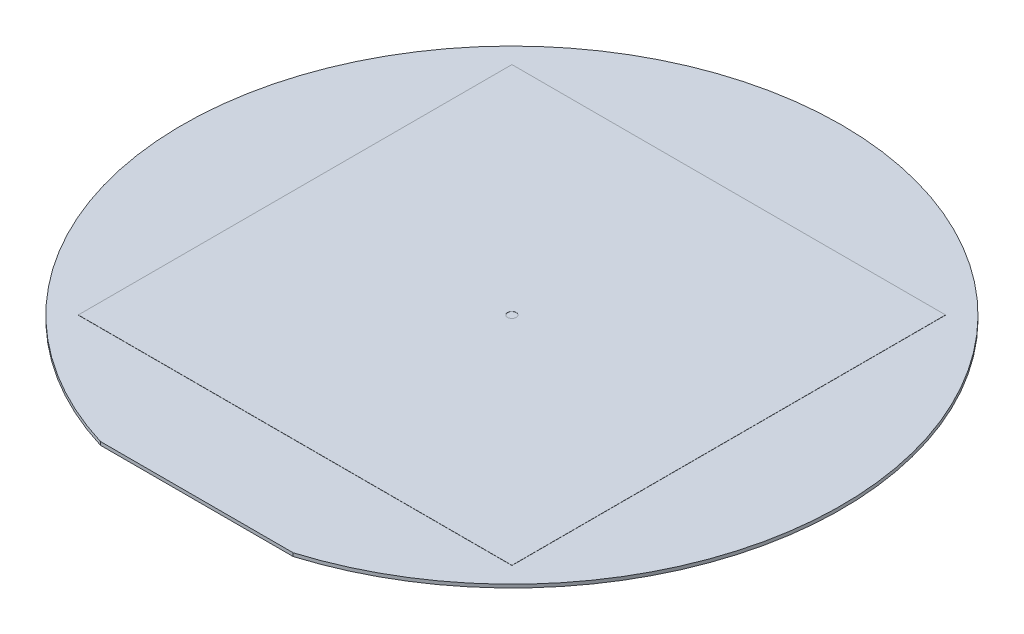
from build123d import *

# Parameters (mm, degrees)
SKETCH1_W           = 50
SKETCH1_H           = 50
SKETCH1_R           = 0.5
BOSS_EXTRUDE1_DEPTH = 0.4
BOSS_EXTRUDE2_DEPTH = 0.381


with BuildPart() as part:
    # Sketch1 → Boss-Extrude1 (new body)
    with BuildSketch(Plane(origin=(0, 0, 0), x_dir=(1, 0, 0), z_dir=(0, 1, 0))):
        Rectangle(SKETCH1_W, SKETCH1_H)
        with Locations(Location((0, 0, 0), (0, 0, 270))):
            Circle(SKETCH1_R, mode=Mode.SUBTRACT)
    extrude(amount=BOSS_EXTRUDE1_DEPTH)

    # Sketch3 → Boss-Extrude2 (add)
    with BuildSketch(Plane(origin=(0, 0, 0), x_dir=(1, 0, 0), z_dir=(0, 1, 0))):
        with BuildLine():
            ThreePointArc((38, 0), (-22.60331834, 30.546521897), (-11.11, -36.339618875))
            Line((-11.11, -36.339618875), (11.11, -36.339618875))
            ThreePointArc((11.11, -36.339618875), (30.546521897, -22.60331834), (38, 0))
        make_face()
    extrude(amount=BOSS_EXTRUDE2_DEPTH)


solid = part.part
